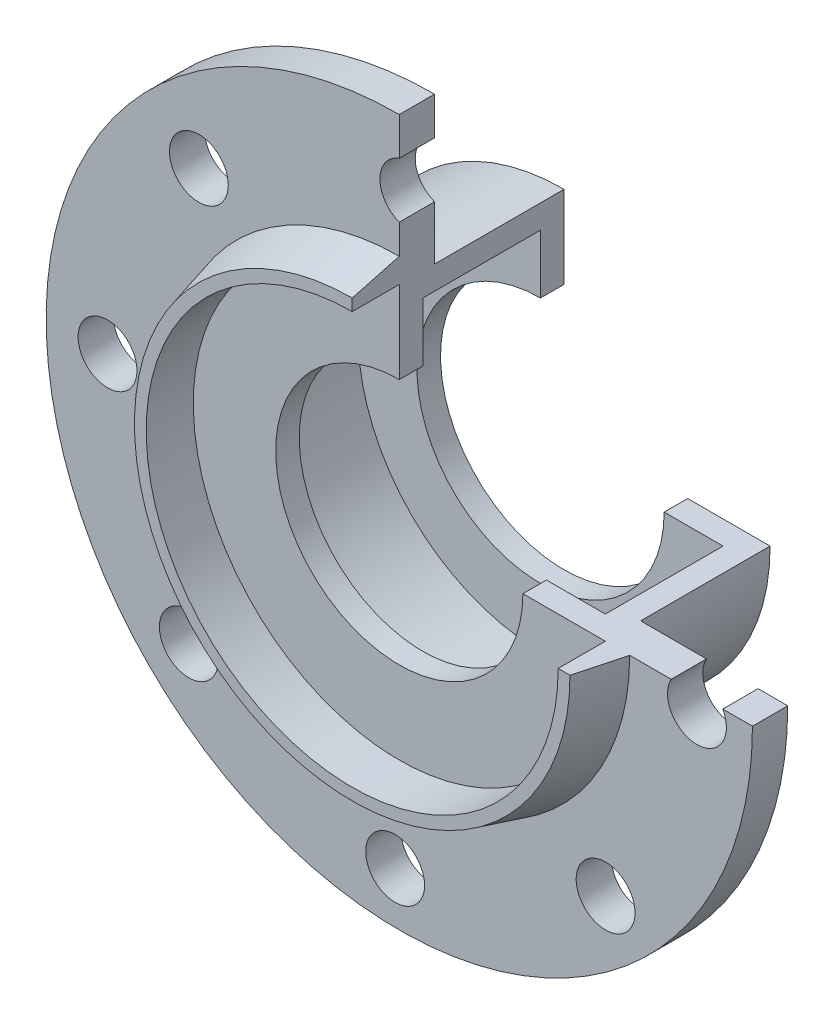
from build123d import *

# Parameters (mm, degrees)
REVOLVE1_ANGLE     = 270
SKETCH3_R          = 5
CUT_EXTRUDE1_DEPTH = 8


with BuildPart() as part:
    # Sketch2 → Revolve1 (revolve)
    with BuildSketch(Plane(origin=(0, 0, 0), x_dir=(0, 0, -1), z_dir=(1, 0, 0))):
        Polygon((0, 0), (-8, 0), (-8, 2), (0, 4.143593539), (0, 25), (6, 25), (6, 0), (28, 0), (28, -14), (24, -14), (24, -4), (4, -4), (4, -14), (0, -14), align=None)
    revolve(axis=Axis((0, -35, 8), (0, 0, 1)), revolution_arc=REVOLVE1_ANGLE)

    # Sketch3 → Cut-Extrude1 (cut)
    with BuildSketch(Plane.XY):
        with Locations((-49.57179677, -35)):
            Circle(SKETCH3_R)
        with Locations((-35.759660433, -70.759660433)):
            Circle(SKETCH3_R)
        with Locations((-0.707106781, -86.278903551)):
            Circle(SKETCH3_R)
        with Locations((35.052553651, -72.466767214)):
            Circle(SKETCH3_R)
        with Locations((50.57179677, -37.414213562)):
            Circle(SKETCH3_R)
        with Locations((36.759660433, -1.65455313)):
            Circle(SKETCH3_R)
        with Locations((1.707106781, 13.864689989)):
            Circle(SKETCH3_R)
        with Locations((-34.052553651, 0.052553651)):
            Circle(SKETCH3_R)
    extrude(amount=-CUT_EXTRUDE1_DEPTH, mode=Mode.SUBTRACT)


solid = part.part
